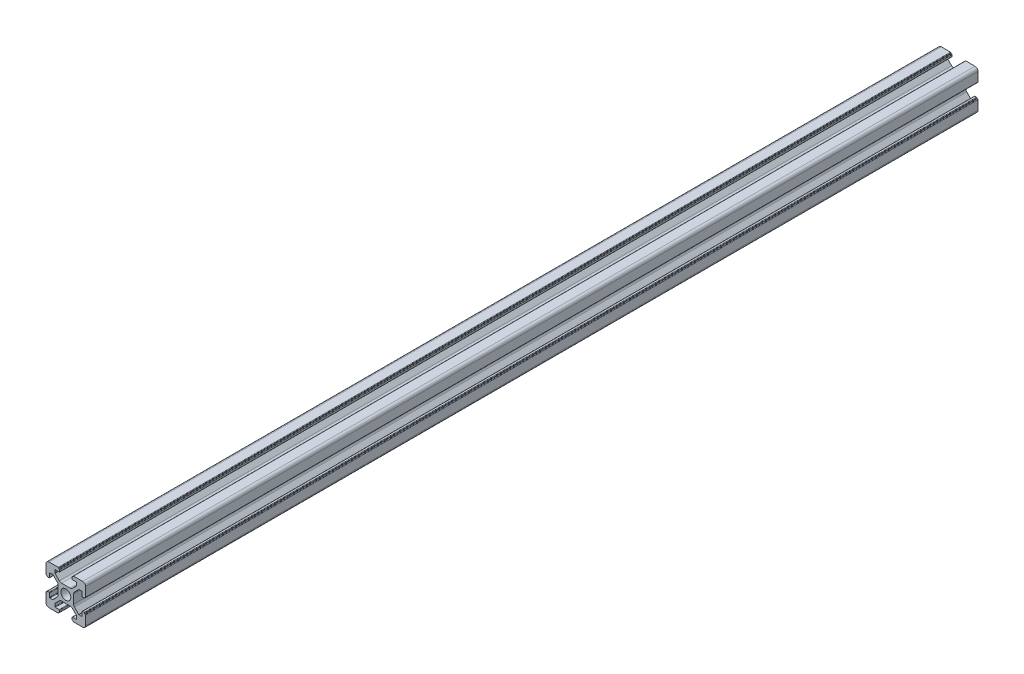
from build123d import *

# Parameters (mm, degrees)
SKETCH_1_R      = 2.5
EXTRUDE_1_DEPTH = 225


with BuildPart() as part:
    # 草图1 → 凸台-拉伸1 (new, symmetric)
    with BuildSketch(Plane.XY):
        with BuildLine():
            Line((-8.502261885, -10.002261885), (-3.85, -10.002261885))
            ThreePointArc((-3.85, -10.002261885), (-3.673223305, -9.929038581), (-3.6, -9.752261885))
            Line((-3.6, -9.752261885), (-3.6, -9.502261885))
            Line((-3.6, -9.502261885), (-3.35, -9.502261885))
            ThreePointArc((-3.35, -9.502261885), (-3.173223305, -9.429038581), (-3.1, -9.252261885))
            Line((-3.1, -9.252261885), (-3.1, -8.45))
            ThreePointArc((-3.1, -8.45), (-3.173223305, -8.273223305), (-3.35, -8.2))
            Line((-3.35, -8.2), (-5.25, -8.2))
            ThreePointArc((-5.25, -8.2), (-5.426776695, -8.126776695), (-5.5, -7.95))
            Line((-5.5, -7.95), (-5.5, -6.664213562))
            ThreePointArc((-5.5, -6.664213562), (-5.480969883, -6.568542704), (-5.426776695, -6.487436867))
            Line((-5.426776695, -6.487436867), (-3.278679656, -4.339339828))
            ThreePointArc((-3.278679656, -4.339339828), (-2.792044633, -4.014180701), (-2.218019485, -3.9))
            Line((-2.218019485, -3.9), (2.218019485, -3.9))
            ThreePointArc((2.218019485, -3.9), (2.792044633, -4.014180701), (3.278679656, -4.339339828))
            Line((3.278679656, -4.339339828), (5.426776695, -6.487436867))
            ThreePointArc((5.426776695, -6.487436867), (5.480969883, -6.568542704), (5.5, -6.664213562))
            Line((5.5, -6.664213562), (5.5, -7.95))
            ThreePointArc((5.5, -7.95), (5.426776695, -8.126776695), (5.25, -8.2))
            Line((5.25, -8.2), (3.35, -8.2))
            ThreePointArc((3.35, -8.2), (3.173223305, -8.273223305), (3.1, -8.45))
            Line((3.1, -8.45), (3.1, -9.252261885))
            ThreePointArc((3.1, -9.252261885), (3.173223305, -9.429038581), (3.35, -9.502261885))
            Line((3.35, -9.502261885), (3.6, -9.502261885))
            Line((3.6, -9.502261885), (3.6, -9.752261885))
            ThreePointArc((3.6, -9.752261885), (3.673223305, -9.929038581), (3.85, -10.002261885))
            Line((3.85, -10.002261885), (8.502261885, -10.002261885))
            ThreePointArc((8.502261885, -10.002261885), (9.562922057, -9.562922057), (10.002261885, -8.502261885))
            Line((10.002261885, -8.502261885), (10.002261885, -3.85))
            ThreePointArc((10.002261885, -3.85), (9.929038581, -3.673223305), (9.752261885, -3.6))
            Line((9.752261885, -3.6), (9.502261885, -3.6))
            Line((9.502261885, -3.6), (9.502261885, -3.35))
            ThreePointArc((9.502261885, -3.35), (9.429038581, -3.173223305), (9.252261885, -3.1))
            Line((9.252261885, -3.1), (8.45, -3.1))
            ThreePointArc((8.45, -3.1), (8.273223305, -3.173223305), (8.2, -3.35))
            Line((8.2, -3.35), (8.2, -5.25))
            ThreePointArc((8.2, -5.25), (8.126776695, -5.426776695), (7.95, -5.5))
            Line((7.95, -5.5), (6.664213562, -5.5))
            ThreePointArc((6.664213562, -5.5), (6.568542704, -5.480969883), (6.487436867, -5.426776695))
            Line((6.487436867, -5.426776695), (4.339339828, -3.278679656))
            ThreePointArc((4.339339828, -3.278679656), (4.014180701, -2.792044633), (3.9, -2.218019485))
            Line((3.9, -2.218019485), (3.9, 2.218019485))
            ThreePointArc((3.9, 2.218019485), (4.014180701, 2.792044633), (4.339339828, 3.278679656))
            Line((4.339339828, 3.278679656), (6.487436867, 5.426776695))
            ThreePointArc((6.487436867, 5.426776695), (6.568542704, 5.480969883), (6.664213562, 5.5))
            Line((6.664213562, 5.5), (7.95, 5.5))
            ThreePointArc((7.95, 5.5), (8.126776695, 5.426776695), (8.2, 5.25))
            Line((8.2, 5.25), (8.2, 3.35))
            ThreePointArc((8.2, 3.35), (8.273223305, 3.173223305), (8.45, 3.1))
            Line((8.45, 3.1), (9.252261885, 3.1))
            ThreePointArc((9.252261885, 3.1), (9.429038581, 3.173223305), (9.502261885, 3.35))
            Line((9.502261885, 3.35), (9.502261885, 3.6))
            Line((9.502261885, 3.6), (9.752261885, 3.6))
            ThreePointArc((9.752261885, 3.6), (9.929038581, 3.673223305), (10.002261885, 3.85))
            Line((10.002261885, 3.85), (10.002261885, 8.502261885))
            ThreePointArc((10.002261885, 8.502261885), (9.562922057, 9.562922057), (8.502261885, 10.002261885))
            Line((8.502261885, 10.002261885), (3.85, 10.002261885))
            ThreePointArc((3.85, 10.002261885), (3.673223305, 9.929038581), (3.6, 9.752261885))
            Line((3.6, 9.752261885), (3.6, 9.502261885))
            Line((3.6, 9.502261885), (3.35, 9.502261885))
            ThreePointArc((3.35, 9.502261885), (3.173223305, 9.429038581), (3.1, 9.252261885))
            Line((3.1, 9.252261885), (3.1, 8.45))
            ThreePointArc((3.1, 8.45), (3.173223305, 8.273223305), (3.35, 8.2))
            Line((3.35, 8.2), (5.25, 8.2))
            ThreePointArc((5.25, 8.2), (5.426776695, 8.126776695), (5.5, 7.95))
            Line((5.5, 7.95), (5.5, 6.664213562))
            ThreePointArc((5.5, 6.664213562), (5.480969883, 6.568542704), (5.426776695, 6.487436867))
            Line((5.426776695, 6.487436867), (3.278679656, 4.339339828))
            ThreePointArc((3.278679656, 4.339339828), (2.792044633, 4.014180701), (2.218019485, 3.9))
            Line((2.218019485, 3.9), (-2.218019485, 3.9))
            ThreePointArc((-2.218019485, 3.9), (-2.792044633, 4.014180701), (-3.278679656, 4.339339828))
            Line((-3.278679656, 4.339339828), (-5.426776695, 6.487436867))
            ThreePointArc((-5.426776695, 6.487436867), (-5.480969883, 6.568542704), (-5.5, 6.664213562))
            Line((-5.5, 6.664213562), (-5.5, 7.95))
            ThreePointArc((-5.5, 7.95), (-5.426776695, 8.126776695), (-5.25, 8.2))
            Line((-5.25, 8.2), (-3.35, 8.2))
            ThreePointArc((-3.35, 8.2), (-3.173223305, 8.273223305), (-3.1, 8.45))
            Line((-3.1, 8.45), (-3.1, 9.252261885))
            ThreePointArc((-3.1, 9.252261885), (-3.173223305, 9.429038581), (-3.35, 9.502261885))
            Line((-3.35, 9.502261885), (-3.6, 9.502261885))
            Line((-3.6, 9.502261885), (-3.6, 9.752261885))
            ThreePointArc((-3.6, 9.752261885), (-3.673223305, 9.929038581), (-3.85, 10.002261885))
            Line((-3.85, 10.002261885), (-8.502261885, 10.002261885))
            ThreePointArc((-8.502261885, 10.002261885), (-9.562922057, 9.562922057), (-10.002261885, 8.502261885))
            Line((-10.002261885, 8.502261885), (-10.002261885, 3.85))
            ThreePointArc((-10.002261885, 3.85), (-9.929038581, 3.673223305), (-9.752261885, 3.6))
            Line((-9.752261885, 3.6), (-9.502261885, 3.6))
            Line((-9.502261885, 3.6), (-9.502261885, 3.35))
            ThreePointArc((-9.502261885, 3.35), (-9.429038581, 3.173223305), (-9.252261885, 3.1))
            Line((-9.252261885, 3.1), (-8.45, 3.1))
            ThreePointArc((-8.45, 3.1), (-8.273223305, 3.173223305), (-8.2, 3.35))
            Line((-8.2, 3.35), (-8.2, 5.25))
            ThreePointArc((-8.2, 5.25), (-8.126776695, 5.426776695), (-7.95, 5.5))
            Line((-7.95, 5.5), (-6.664213562, 5.5))
            ThreePointArc((-6.664213562, 5.5), (-6.568542704, 5.480969883), (-6.487436867, 5.426776695))
            Line((-6.487436867, 5.426776695), (-4.339339828, 3.278679656))
            ThreePointArc((-4.339339828, 3.278679656), (-4.014180701, 2.792044633), (-3.9, 2.218019485))
            Line((-3.9, 2.218019485), (-3.9, -2.218019485))
            ThreePointArc((-3.9, -2.218019485), (-4.014180701, -2.792044633), (-4.339339828, -3.278679656))
            Line((-4.339339828, -3.278679656), (-6.487436867, -5.426776695))
            ThreePointArc((-6.487436867, -5.426776695), (-6.568542704, -5.480969883), (-6.664213562, -5.5))
            Line((-6.664213562, -5.5), (-7.95, -5.5))
            ThreePointArc((-7.95, -5.5), (-8.126776695, -5.426776695), (-8.2, -5.25))
            Line((-8.2, -5.25), (-8.2, -3.35))
            ThreePointArc((-8.2, -3.35), (-8.273223305, -3.173223305), (-8.45, -3.1))
            Line((-8.45, -3.1), (-9.252261885, -3.1))
            ThreePointArc((-9.252261885, -3.1), (-9.429038581, -3.173223305), (-9.502261885, -3.35))
            Line((-9.502261885, -3.35), (-9.502261885, -3.6))
            Line((-9.502261885, -3.6), (-9.752261885, -3.6))
            ThreePointArc((-9.752261885, -3.6), (-9.929038581, -3.673223305), (-10.002261885, -3.85))
            Line((-10.002261885, -3.85), (-10.002261885, -8.502261885))
            ThreePointArc((-10.002261885, -8.502261885), (-9.562922057, -9.562922057), (-8.502261885, -10.002261885))
        make_face()
        Circle(SKETCH_1_R, mode=Mode.SUBTRACT)
    extrude(amount=EXTRUDE_1_DEPTH, both=True)


solid = part.part
